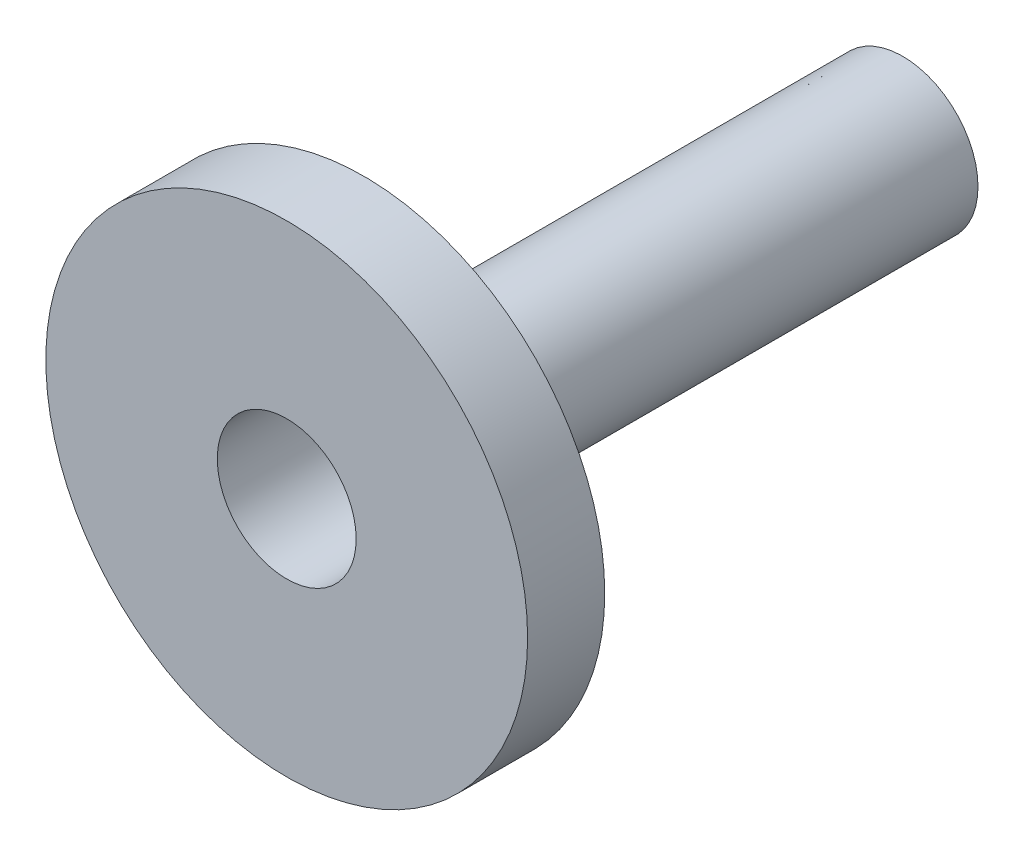
from build123d import *

# Parameters (mm, degrees)
SKETCH1_R      = 19.5
SKETCH1_R_2    = 18
EXTRUDE1_DEPTH = 139.7
EXTRUDE2_START = 19.9898
SKETCH2_R      = 62.446297133
SKETCH2_R_2    = 18
EXTRUDE2_DEPTH = 19.9898


with BuildPart() as part:
    # Sketch1 → Extrude1 (new body)
    with BuildSketch(Plane.XY):
        Circle(SKETCH1_R)
        Circle(SKETCH1_R_2, mode=Mode.SUBTRACT)
    extrude(amount=-EXTRUDE1_DEPTH)

    # Sketch2 → Extrude2 (add)
    with BuildSketch(Plane.XY.offset(EXTRUDE2_START)):
        Circle(SKETCH2_R)
        Circle(SKETCH2_R_2, mode=Mode.SUBTRACT)
    extrude(amount=-EXTRUDE2_DEPTH)

    # Sketch3 → Revolve1 (revolve)
    with BuildSketch(Plane(origin=(0, 0, 0), x_dir=(0, 0, -1), z_dir=(1, 0, 0)), mode=Mode.PRIVATE) as revolve1_sk:
        Polygon((139.7, 18), (139.7, 14.5), (136.2, 18), align=None)
    revolve(revolve1_sk.sketch.rotate(Axis((0, 0, -143.10013627), (0, 0, 1)), 270), axis=Axis((0, 0, -143.10013627), (0, 0, 1)))


solid = part.part
